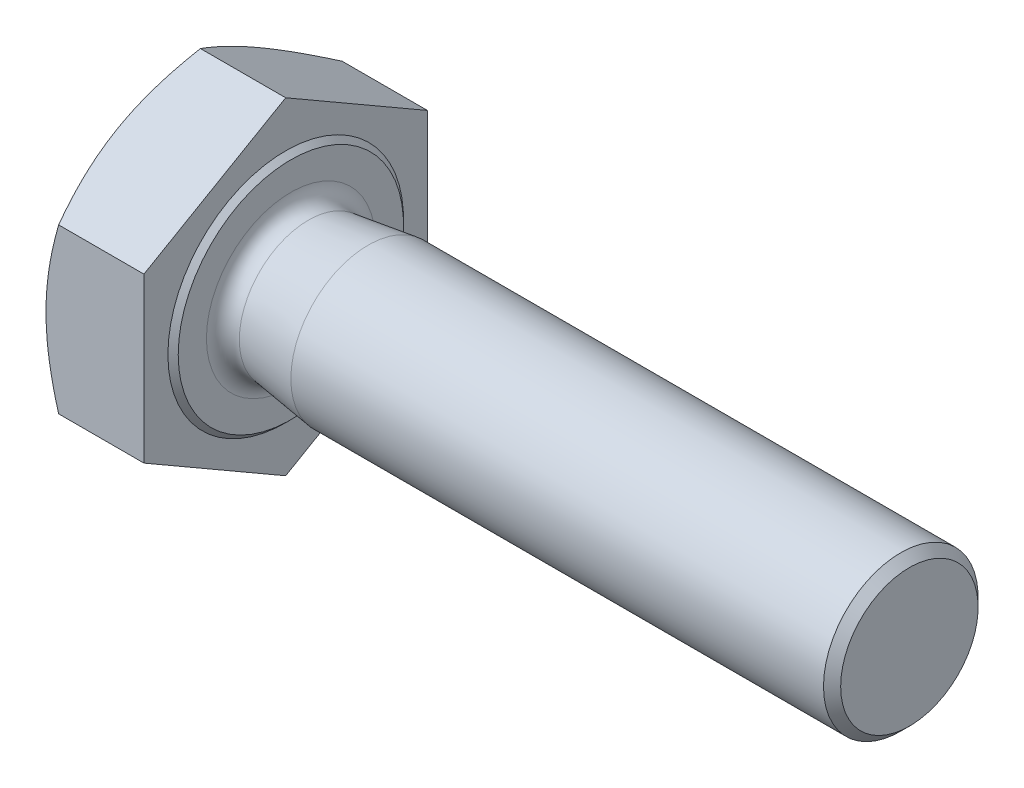
from build123d import *

# Parameters (mm, degrees)
EXTRUDE_1_DEPTH     = 2
SKETCH_4_R          = 6.01
SKETCH_4_R_2        = 2.75
CUT_EXTRUDE_1_DEPTH = 0.25
CUT_EXTRUDE_1_DRAFT = -60
CHAMFER_1_SIZE      = 0.166666667


with BuildPart() as part:
    # 草图3 → 凸台-拉伸1 (new body)
    with BuildSketch(Plane(origin=(0, 0, 0), x_dir=(0, 0, -1), z_dir=(1, 0, 0))):
        Polygon((2.75, 1.58771324), (0, 3.175426481), (-2.75, 1.58771324), (-2.75, -1.58771324), (0, -3.175426481), (2.75, -1.58771324), align=None)
    extrude(amount=EXTRUDE_1_DEPTH)


with BuildPart() as cut_extrude_1_tool:
    # 草图4 → 切除-拉伸1 (with draft: the straight prism first)
    with BuildSketch(Plane.ZY):
        Circle(SKETCH_4_R)
        Circle(SKETCH_4_R_2, mode=Mode.SUBTRACT)
    extrude(amount=-CUT_EXTRUDE_1_DEPTH)
    # 切除-拉伸1: the draft: its side faces are tilted about the plane it starts from
    cut_extrude_1_sides = [cut_extrude_1_tool.faces().sort_by_distance(p)[0] for p in [
        (0.125, 0, -6.01),
        (0.125, 0, -2.75),
    ]]
    draft(cut_extrude_1_sides, Plane.ZY, CUT_EXTRUDE_1_DRAFT)


with BuildPart() as part_1:
    add(part.part)

    # 切除-拉伸1: cut by cut_extrude_1_tool
    add(cut_extrude_1_tool.part, mode=Mode.SUBTRACT)

    # 草图6 → 旋转2 (revolve)
    with BuildSketch(Plane.XY, mode=Mode.PRIVATE) as revolve_2_sk:
        with BuildLine():
            Line((3.5, 1.5), (14, 1.5))
            Line((14, 1.5), (14, 0))
            Line((14, 0), (2, 0))
            Line((2, 0), (2, 1.637625))
            ThreePointArc((2, 1.637625), (2.102863718, 1.411489452), (2.340915241, 1.340428191))
            Line((2.340915241, 1.340428191), (3.5, 1.5))
        make_face()
    revolve(revolve_2_sk.sketch.rotate(Axis((2, 0, 0), (1, 0, 0)), 90), axis=Axis((2, 0, 0), (1, 0, 0)))

    # 倒角1
    chamfer_1_edges = [part_1.edges().sort_by_distance(p)[0] for p in [
        (14, 0, -1.5),
    ]]
    chamfer(chamfer_1_edges, length=CHAMFER_1_SIZE)

    # 草图8 → 切除-旋转2 (revolve, cut)
    with BuildSketch(Plane.XY, mode=Mode.PRIVATE) as cut_revolve_2_sk:
        Polygon((2, 2.185), (1.9, 2.285), (1.9, 6.01), (2, 6.01), align=None)
    revolve(cut_revolve_2_sk.sketch.rotate(Axis((0, 0, 0), (1, 0, 0)), 90), axis=Axis((0, 0, 0), (1, 0, 0)), mode=Mode.SUBTRACT)


solid = part_1.part
